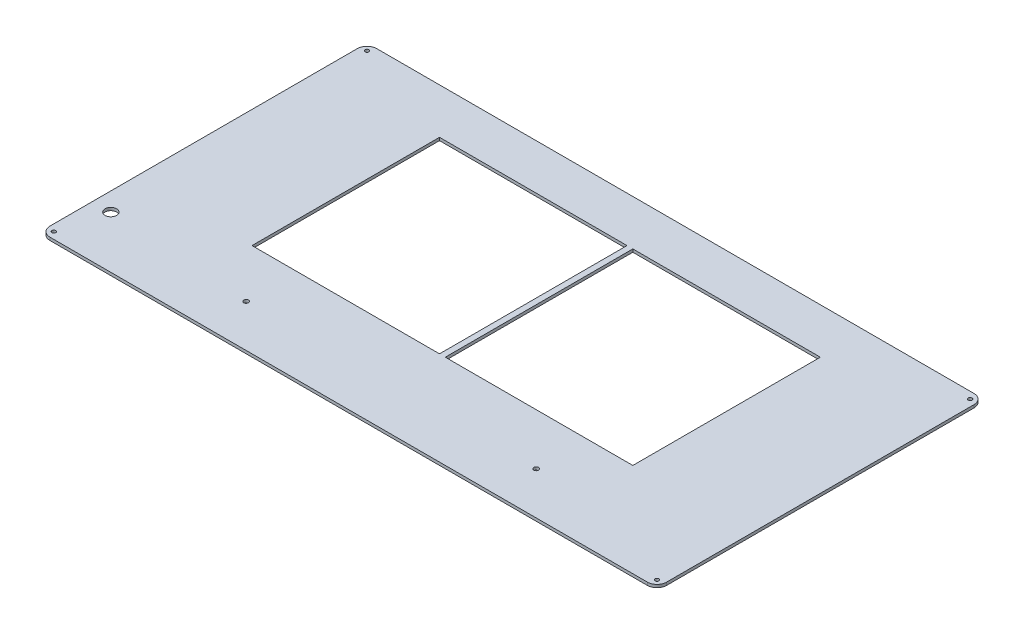
from build123d import *

# Parameters (mm, degrees)
SKETCH_1_R      = 2
SKETCH_1_R_2    = 6
SKETCH_1_R_3    = 2.5
EXTRUDE_1_DEPTH = 3


with BuildPart() as part:
    # 草图1 → 凸台-拉伸1 (new body)
    with BuildSketch(Plane(origin=(0, 0, 0), x_dir=(1, 0, 0), z_dir=(0, 1, 0))):
        with BuildLine():
            Line((630, 344), (20, 344))
            Line((20, 344), (16, 344))
            ThreePointArc((16, 344), (8.928932188, 341.071067812), (6, 334))
            Line((6, 334), (6, 330))
            Line((6, 330), (6, 20))
            Line((6, 20), (6, 16))
            ThreePointArc((6, 16), (8.928932188, 8.928932188), (16, 6))
            Line((16, 6), (20, 6))
            Line((20, 6), (630, 6))
            Line((630, 6), (634, 6))
            ThreePointArc((634, 6), (641.071067812, 8.928932188), (644, 16))
            Line((644, 16), (644, 20))
            Line((644, 20), (644, 330))
            Line((644, 330), (644, 334))
            ThreePointArc((644, 334), (641.071067812, 341.071067812), (634, 344))
            Line((634, 344), (630, 344))
        make_face()
        with Locations(Location((13, 13, 0), (0, 0, 270))):
            Circle(SKETCH_1_R, mode=Mode.SUBTRACT)
        with Locations(Location((25, 60, 0), (0, 0, 270))):
            Circle(SKETCH_1_R_2, mode=Mode.SUBTRACT)
        with Locations(Location((175, 50, 0), (0, 0, 270))):
            Circle(SKETCH_1_R_3, mode=Mode.SUBTRACT)
        with Locations(Location((475, 50, 0), (0, 0, 270))):
            Circle(SKETCH_1_R_3, mode=Mode.SUBTRACT)
        with Locations(Location((637, 13, 0), (0, 0, 270))):
            Circle(SKETCH_1_R, mode=Mode.SUBTRACT)
        Polygon((322, 297), (322, 175), (322, 103), (128, 103), (128, 297), align=None, mode=Mode.SUBTRACT)
        with Locations(Location((13, 337, 0), (0, 0, 270))):
            Circle(SKETCH_1_R, mode=Mode.SUBTRACT)
        Polygon((522, 297), (522, 103), (328, 103), (328, 175), (328, 297), align=None, mode=Mode.SUBTRACT)
        with Locations(Location((637, 337, 0), (0, 0, 270))):
            Circle(SKETCH_1_R, mode=Mode.SUBTRACT)
    extrude(amount=-EXTRUDE_1_DEPTH)


solid = part.part
